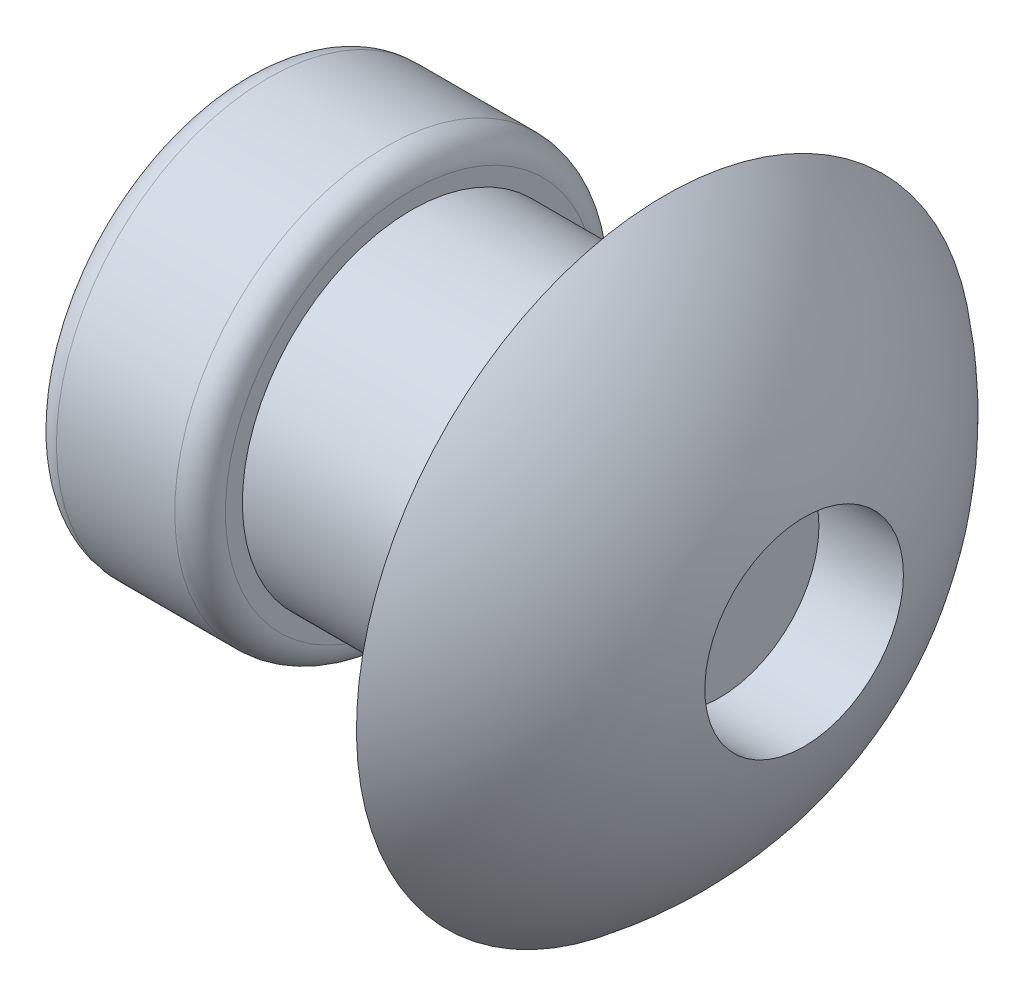
from build123d import *

# Parameters (mm, degrees)
FILLET1_R      = 0.5
CHAMFER1_SIZE  = 2.35
CHAMFER1_SIZE2 = 0.629680602
SKETCH_1_W     = 29
SKETCH_1_H     = 1.175


with BuildPart() as part:
    # Sketch1 → Base-Revolve (revolve)
    with BuildSketch(Plane(origin=(-11.603452862, 14.723452862, 0), x_dir=(0, -1, 0), z_dir=(0, 0, 1)), mode=Mode.PRIVATE) as base_revolve_sk:
        with BuildLine():
            Line((16.923452862, 12.103452862), (16.598206218, 12.103452862))
            ThreePointArc((16.598206218, 12.103452862), (16.304826689, 11.774384722), (15.898452862, 11.603452862))
            Line((15.898452862, 11.603452862), (14.723452862, 11.603452862))
            Line((14.723452862, 11.603452862), (14.723452862, 46.750877613))
            Line((14.723452862, 46.750877613), (15.898452862, 46.750877613))
            Line((15.898452862, 46.750877613), (15.898452862, 18.750877613))
            ThreePointArc((15.898452862, 18.750877613), (17.272699482, 18.132605809), (18.373452862, 17.103452862))
            Line((18.373452862, 17.103452862), (16.723452862, 17.103452862))
            Line((16.723452862, 17.103452862), (16.723452862, 14.103452862))
            Line((16.723452862, 14.103452862), (16.923452862, 14.103452862))
            ThreePointArc((16.923452862, 14.103452862), (17.135584897, 14.015584897), (17.223452862, 13.803452862))
            Line((17.223452862, 13.803452862), (17.223452862, 12.403452862))
            ThreePointArc((17.223452862, 12.403452862), (17.135584897, 12.191320828), (16.923452862, 12.103452862))
        make_face()
    revolve(base_revolve_sk.sketch.rotate(Axis((22.234231882, 0, 0), (-1, 0, 0)), 180), axis=Axis((22.234231882, 0, 0), (-1, 0, 0)))

    # Fillet1
    fillet1_edges = [part.edges().sort_by_distance(p)[0] for p in [
        (5.5, -2, 0),
    ]]
    fillet(fillet1_edges, radius=FILLET1_R)

    # Chamfer1
    chamfer1_edges = [part.edges().sort_by_distance(p)[0] for p in [
        (35.14742475, -1.175, 0),
    ]]
    chamfer1_side = [part.faces().sort_by_distance(p)[0] for p in [
        (21.14742475, -1.175, 0),
    ]]
    chamfer(chamfer1_edges, length=CHAMFER1_SIZE, length2=CHAMFER1_SIZE2, reference=chamfer1_side[0])

    # Эскиз1 → Вырез-Повернуть1 (revolve, cut)
    with BuildSketch(Plane(origin=(0, 0, 0), x_dir=(1, 0, 0), z_dir=(0, 1, 0))):
        with Locations((20.64742475, 0.5875)):
            Rectangle(SKETCH_1_W, SKETCH_1_H)
    revolve(axis=Axis((35.14742475, 0, 0), (-1, 0, 0)), mode=Mode.SUBTRACT)


solid = part.part
